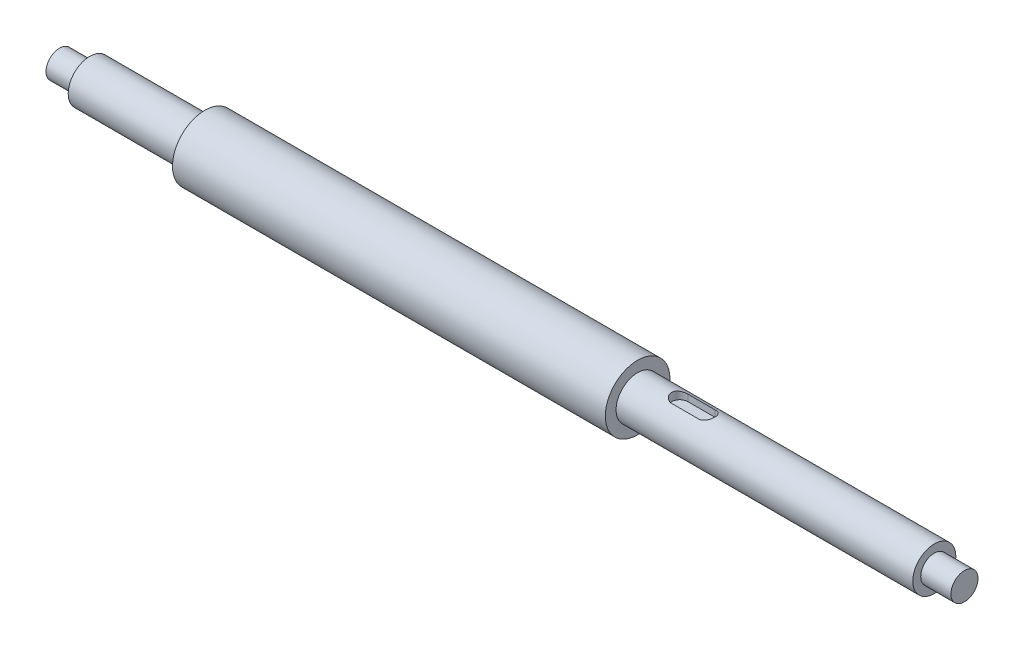
from build123d import *

# Parameters (mm, degrees)
SKETCH1_R           = 9.525
BOSS_EXTRUDE1_DEPTH = 266.7
SKETCH4_R           = 9.525
SKETCH4_R_2         = 6.35
CUT_EXTRUDE3_DEPTH  = 42.799
SKETCH5_R           = 6.35
SKETCH5_R_2         = 4
CUT_EXTRUDE4_DEPTH  = 8.89
CUT_EXTRUDE5_START  = -96.3295
SKETCH6_R           = 9.525
SKETCH6_R_2         = 6.35
CUT_EXTRUDE5_DEPTH  = 96.3295
CUT_EXTRUDE6_DEPTH  = 2.3876


with BuildPart() as part:
    # Sketch1 → Boss-Extrude1 (new body)
    with BuildSketch(Plane(origin=(0, 0, 0), x_dir=(0, 0, -1), z_dir=(1, 0, 0))):
        Circle(SKETCH1_R)
    extrude(amount=BOSS_EXTRUDE1_DEPTH)

    # Sketch4 → Cut-Extrude3 (cut)
    with BuildSketch(Plane.ZY):
        Circle(SKETCH4_R)
        Circle(SKETCH4_R_2, mode=Mode.SUBTRACT)
    extrude(amount=-CUT_EXTRUDE3_DEPTH, mode=Mode.SUBTRACT)

    # Sketch5 → Cut-Extrude4 (cut)
    with BuildSketch(Plane.ZY):
        Circle(SKETCH5_R)
        Circle(SKETCH5_R_2, mode=Mode.SUBTRACT)
    cut_extrude4 = extrude(amount=-CUT_EXTRUDE4_DEPTH, mode=Mode.SUBTRACT)

    # Sketch6 → Cut-Extrude5 (cut)
    with BuildSketch(Plane(origin=(266.7, 0, 0), x_dir=(0, 0, -1), z_dir=(1, 0, 0)).offset(CUT_EXTRUDE5_START)):
        with Locations(Location((0, 0, 0), (0, 0, 180))):
            Circle(SKETCH6_R)
        with Locations(Location((0, 0, 0), (0, 0, 180))):
            Circle(SKETCH6_R_2, mode=Mode.SUBTRACT)
    extrude(amount=CUT_EXTRUDE5_DEPTH, mode=Mode.SUBTRACT)

    # Mirror1: Cut-Extrude4 across plane
    add(cut_extrude4.mirror(Plane.ZY.offset(-133.35)), mode=Mode.SUBTRACT)

    # Sketch7 → Cut-Extrude6 (cut)
    with BuildSketch(Plane(origin=(0, 6.35, 0), x_dir=(1, 0, 0), z_dir=(0, 1, 0))):
        with BuildLine():
            Line((182.7911, 2.38125), (190.7286, 2.38125))
            ThreePointArc((190.7286, 2.38125), (193.10985, 0), (190.7286, -2.38125))
            Line((190.7286, -2.38125), (182.7911, -2.38125))
            ThreePointArc((182.7911, -2.38125), (180.40985, 0), (182.7911, 2.38125))
        make_face()
    extrude(amount=-CUT_EXTRUDE6_DEPTH, mode=Mode.SUBTRACT)


solid = part.part
